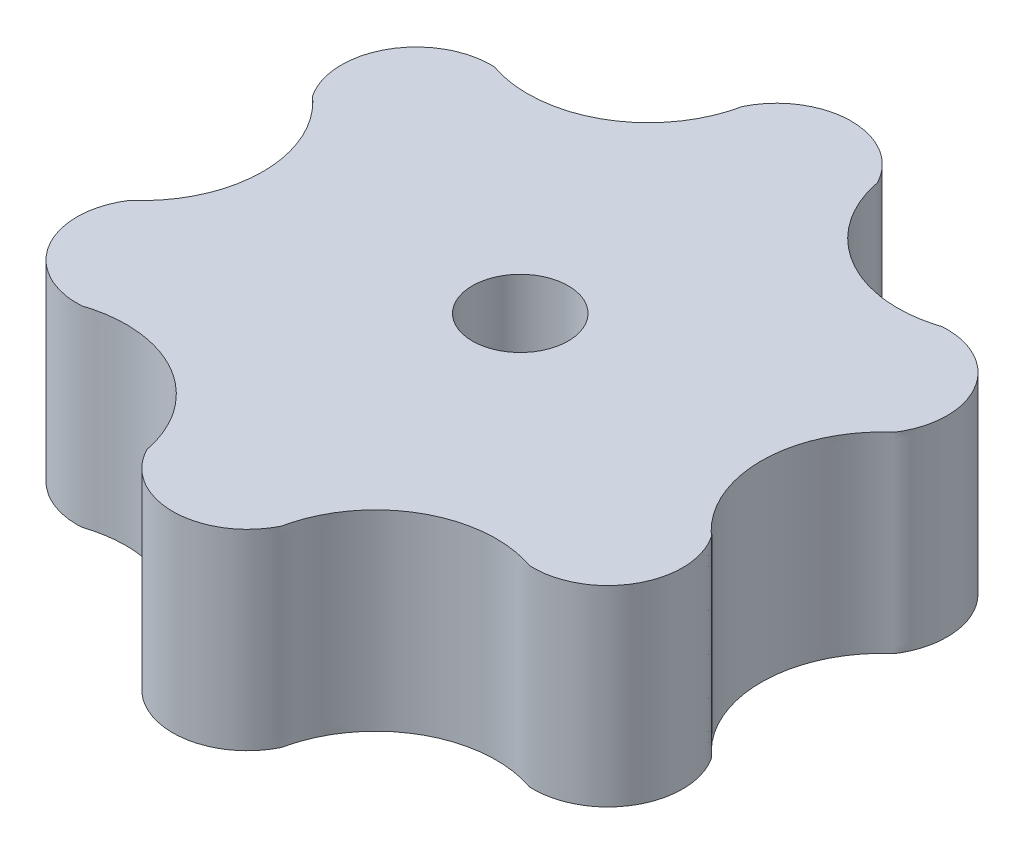
from build123d import *

# Parameters (mm, degrees)
EXTRUDE_1_DEPTH     = 20
SKETCH_3_R          = 5
CUT_EXTRUDE_1_DEPTH = 81.467811189


with BuildPart() as part:
    # 草图2 → 凸台-拉伸1 (new body)
    with BuildSketch(Plane.XZ):
        with BuildLine():
            add(Edge.make_bspline(
                [(0, 0), (0.037048104, 0.007327255), (0.073592948, 0.017199097), (0.147185896, 0.034398194), (0.257575318, 0.060196839), (0.367964741, 0.085995484), (0.588743585, 0.137592774), (0.731993745, 0.18653521), (0.948664485, 0.253313715), (1.021446681, 0.27396319), (1.162426399, 0.328475965), (1.303406118, 0.382988741), (1.444385837, 0.437501516), (1.585365556, 0.492014291), (1.652866118, 0.52625935), (1.858055963, 0.622709885), (1.996944408, 0.682933604), (2.260764564, 0.830536519), (2.392674642, 0.904337976), (2.557562239, 0.996589798), (2.58821449, 1.018871362), (2.651393533, 1.060345927), (2.746162098, 1.122557773), (2.856725423, 1.19513826), (2.935699227, 1.246981465), (2.967288748, 1.267718747), (2.983752674, 1.277142575), (3.028821983, 1.311517073), (3.118960601, 1.380266067), (3.239145424, 1.471931393), (3.329284042, 1.540680387), (3.389376454, 1.58651305), (3.420275984, 1.608388713), (3.505352052, 1.683311722), (3.618786809, 1.783209067), (3.732221567, 1.883106413), (3.817297635, 1.958029422), (3.845666165, 1.982993342), (3.898750117, 2.036787626), (3.978376047, 2.117479051), (4.058001976, 2.198170475), (4.164169881, 2.305759042), (4.218021081, 2.358847022), (4.365702211, 2.530881502), (4.464156298, 2.645571156), (4.587223906, 2.788933222), (4.609103355, 2.819794289), (4.654281279, 2.880380477), (4.722048164, 2.971259758), (4.789815049, 3.06213904), (4.92534882, 3.243897604), (5.004625157, 3.372762018), (5.127545598, 3.563277486), (5.169834711, 3.625994661), (5.243132771, 3.758185123), (5.316430831, 3.890375584), (5.38972889, 4.022566046), (5.435540178, 4.105185085), (5.436967022, 4.12460388), (5.444842291, 4.161562139), (5.456655193, 4.216999527), (5.468468095, 4.272436915), (5.507844437, 4.457228209), (5.537366909, 4.605547327), (5.613697906, 4.898055915), (5.649453958, 5.044970309), (5.774570036, 5.480823817), (5.868997273, 5.768153523), (6.178655793, 6.620562379), (6.426706694, 7.173687914), (6.785179557, 7.839022642), (6.862029079, 7.969223694), (6.974805174, 8.165914138), (7.011074053, 8.232310745), (7.092767977, 8.35948396), (7.133614939, 8.423070568), (7.256155825, 8.61383039), (7.335483539, 8.742605112), (7.510886902, 8.988819156), (7.598588583, 9.111926177), (7.773991946, 9.358140221), (7.869954288, 9.475064487), (8.010841588, 9.652705549), (8.057804022, 9.711919236), (8.151728889, 9.830346611), (8.201877598, 9.886959998), (8.351806289, 10.057039292), (8.449841582, 10.172163345), (8.604428955, 10.338019676), (8.655665565, 10.393584607), (8.761429702, 10.50157012), (8.81431177, 10.555562877), (9.078722112, 10.825526661), (9.300566119, 11.031220321), (9.585932888, 11.278927972), (9.641920159, 11.329752813), (9.758511893, 11.425946843), (9.816807759, 11.474043858), (9.933399492, 11.570237889), (9.994164106, 11.615255193), (10.113422544, 11.708122566), (10.173051762, 11.754556252), (10.351939418, 11.893857311), (10.477274205, 11.978577027), (10.66334863, 12.10812195), (10.725373438, 12.151303591), (10.849423054, 12.237666873), (10.913121909, 12.278361363), (11.103182215, 12.401984412), (11.233293803, 12.478999613), (11.426776626, 12.597194265), (11.492243651, 12.634942172), (11.623652215, 12.709632955), (11.688826556, 12.747942221), (11.889032374, 12.854352789), (12.021795975, 12.926675342), (12.225253822, 13.026727744), (12.293073104, 13.060078545), (12.428711668, 13.126780146), (12.497444061, 13.158205799), (12.63491584, 13.221042365), (12.703563122, 13.252662825), (12.842937936, 13.311157141), (12.912625343, 13.340404299), (13.121687564, 13.428145774), (13.261057355, 13.486934843), (13.54626694, 13.587150552), (13.688871732, 13.637258406), (13.974081316, 13.737474114), (14.119563463, 13.778764106), (14.410194856, 13.861957187), (14.554834701, 13.906045959), (14.774467382, 13.962322632), (14.848659945, 13.976991941), (14.996157757, 14.010027061), (15.143655569, 14.043062182), (15.291153381, 14.076097302), (15.438651194, 14.109132422), (15.513670901, 14.119139474), (15.737311977, 14.156425499), (15.886406028, 14.181282849), (16.184594129, 14.230997548), (16.335466428, 14.243137364), (16.636028153, 14.275546384), (16.786178657, 14.294185993), (17.088096561, 14.30945931), (17.239055514, 14.317095968), (17.540973418, 14.332369285), (17.692216112, 14.331329423), (17.918940617, 14.330073592), (17.994515453, 14.329654982), (18.145665123, 14.328817762), (18.221167175, 14.324782198), (18.447758663, 14.316916068), (18.59856207, 14.30627893), (18.824871786, 14.292513365), (18.899990086, 14.28369556), (19.050537446, 14.270189403), (19.125776554, 14.263099484), (19.275928742, 14.245743095), (19.35116818, 14.238322287), (19.500771129, 14.216737998), (19.575572603, 14.205945854), (19.799977026, 14.17356942), (19.949432863, 14.150694013), (20.245942727, 14.091790741), (20.394748578, 14.064943628), (20.689713385, 13.998735942), (20.835887509, 13.960151641), (21.055686422, 13.90452776), (21.129160749, 13.886768579), (21.2747537, 13.846153108), (21.346609765, 13.822639352), (21.491073333, 13.778173621), (21.59942101, 13.744824323), (21.725826632, 13.705916809), (21.78000047, 13.68924216), (21.807087389, 13.680904835), (21.816909796, 13.682904887), (21.835795041, 13.682329812), (21.996319622, 13.677441679), (22.156844203, 13.672553546), (22.345696652, 13.666802801), (22.383453813, 13.670257277), (22.45898021, 13.672994856), (22.572269805, 13.677101225), (22.6855594, 13.681207593), (22.798848995, 13.685313962), (22.8366213, 13.686553032), (22.911789323, 13.694395182), (23.024541357, 13.706158406), (23.174877402, 13.721842705), (23.287629436, 13.73360593), (23.362797459, 13.741448079), (23.400070471, 13.747603833), (23.511749842, 13.767074651), (23.660655669, 13.793035742), (23.809561497, 13.818996832), (23.921240868, 13.838467651), (23.957594175, 13.849109193), (24.030967718, 13.867221458), (24.141028033, 13.894389855), (24.251088347, 13.921558252), (24.361148662, 13.948726649), (24.398395758, 13.955812066), (24.470322619, 13.979012446), (24.57821291, 14.013813016), (24.722066632, 14.060213776), (24.829956923, 14.095014346), (24.901883784, 14.118214726), (24.938095402, 14.129129096), (25.113386772, 14.199636216), (25.253619868, 14.256041912), (25.428911238, 14.326549032), (25.463803079, 14.341025369), (25.531751289, 14.374112703), (25.633673605, 14.423743703), (25.735595921, 14.473374704), (25.871492341, 14.539549371), (25.940011933, 14.571561692), (26.07088896, 14.647179994), (26.201765987, 14.722798296), (26.332643013, 14.798416598), (26.46352004, 14.8740349), (26.52479581, 14.918494271), (26.712604644, 15.045511673), (26.840373555, 15.12667357), (27.078252974, 15.313224039), (27.197192683, 15.406499273), (27.34586732, 15.523093316), (27.372425396, 15.550183387), (27.428486685, 15.600867338), (27.512578617, 15.676893264), (27.59667055, 15.752919191), (27.764854415, 15.904971043), (27.866991214, 16.016641847), (28.024225119, 16.179991404), (28.078141077, 16.233089278), (28.175247338, 16.348922339), (28.272353598, 16.4647554), (28.369459859, 16.58058846), (28.46656612, 16.696421521), (28.508791372, 16.759287994), (28.597836883, 16.881426525), (28.642359638, 16.94249579), (28.709143771, 17.034099688), (28.732945232, 17.063588353), (28.773297993, 17.127489727), (28.833827136, 17.223341787), (28.894356279, 17.319193848), (28.975061802, 17.446996595), (29.016255495, 17.510405051), (29.124378948, 17.70969102), (29.196461249, 17.842548333), (29.277553839, 17.99201281), (29.284402478, 18.009701065), (29.300168374, 18.044043011), (29.323817217, 18.09555593), (29.378997851, 18.215752742), (29.426295537, 18.318778581), (29.473593224, 18.42180442), (29.489170441, 18.456225369), (29.515984176, 18.526884796), (29.556204779, 18.632873936), (29.609832249, 18.774192789), (29.650052852, 18.880181928), (29.676866587, 18.950841355), (29.709718909, 19.059340767), (29.764473379, 19.240172917), (29.808276955, 19.384838637), (29.841129636, 19.493337927), (29.847649537, 19.530679872), (29.864483352, 19.604357233), (29.889734075, 19.714873276), (29.914984798, 19.825389318), (29.94023552, 19.935905361), (29.95032394, 19.972423209), (29.961964931, 20.047097289), (29.979426416, 20.15910841), (29.996887902, 20.27111953), (30.020169882, 20.420467691), (30.034834137, 20.494779041), (30.053895797, 20.72070432), (30.06660357, 20.871321172), (30.082488287, 21.059592238), (30.084907693, 21.097283482), (30.085929208, 21.172852573), (30.08746148, 21.286206208), (30.088993751, 21.399559844), (30.09103678, 21.550698026), (30.092926782, 21.626286134), (30.084269801, 21.777190012), (30.07561282, 21.92809389), (30.066955839, 22.078997768), (30.058298859, 22.229901646), (30.045816346, 22.304596005), (30.016878612, 22.529469716), (30.001540976, 22.680036678), (29.941945096, 22.976408111), (29.912147156, 23.124593827), (29.878624473, 23.291302758), (29.872341069, 23.309217603), (29.86231902, 23.345652356), (29.847285947, 23.400304487), (29.812208776, 23.527826125), (29.78214263, 23.637130386), (29.722010338, 23.855738908), (29.667902244, 23.997092901), (29.59275452, 24.211005028), (29.569274415, 24.282921575), (29.509512543, 24.421757602), (29.449750671, 24.56059363), (29.389988799, 24.699429657), (29.330226927, 24.838265684), (29.292777073, 24.904117326), (29.223758731, 25.03859183), (29.189249559, 25.105829082), (29.137485803, 25.20668496), (29.121570615, 25.241048486), (29.082655203, 25.305835226), (29.024282084, 25.403015335), (28.94645126, 25.532588814), (28.888078141, 25.629768924), (28.858891582, 25.678358978), (28.851396161, 25.696395545), (28.823327078, 25.721694938), (28.697016202, 25.835542206), (28.570705326, 25.949389475), (28.402290824, 26.101185832), (28.349435847, 26.155289995), (28.241858197, 26.261468962), (28.188069371, 26.314558445), (28.026702896, 26.473826895), (27.923599548, 26.584384372), (27.410788634, 27.139540261), (27.032717103, 27.613193919), (26.604537496, 28.235958176), (26.523335338, 28.363475304), (26.399782149, 28.553581032), (26.360038413, 28.617862215), (26.280645909, 28.746484741), (26.244300849, 28.812803829), (26.130355472, 29.00881921), (26.052992711, 29.138758002), (25.91442361, 29.407433083), (25.845139059, 29.541770624), (25.741212233, 29.743276935), (25.710521127, 29.812365035), (25.647755217, 29.949869087), (25.616372262, 30.018621113), (25.553606352, 30.156125165), (25.52051048, 30.224123326), (25.461513605, 30.363286153), (25.43399248, 30.433677646), (25.350592884, 30.644509536), (25.29297818, 30.784298926), (25.189549518, 31.068359143), (25.143106671, 31.212235839), (25.04666664, 31.498744155), (25.003583332, 31.643659462), (24.942623545, 31.86203868), (24.922303616, 31.934831753), (24.881663758, 32.080417898), (24.864422606, 32.154024231), (24.827864407, 32.300688548), (24.810459842, 32.374227167), (24.777564605, 32.521756239), (24.759454914, 32.595174619), (24.716350374, 32.817767469), (24.685960319, 32.965863892), (24.648440569, 33.189465875), (24.635621128, 33.263951904), (24.614826584, 33.413666668), (24.604429312, 33.48852405), (24.573237495, 33.713096197), (24.554524329, 33.863103847), (24.535365687, 34.089020922), (24.528979473, 34.164326614), (24.516207046, 34.314937997), (24.508063376, 34.390122503), (24.500042238, 34.541061514), (24.495475595, 34.616509362), (24.488576239, 34.767492064), (24.488244822, 34.843104866), (24.48450187, 34.994210505), (24.482630394, 35.069763324), (24.478887442, 35.220868963), (24.481310509, 35.296460504), (24.482837048, 35.523183349), (24.489182685, 35.67422046), (24.497138624, 35.900808813), (24.502987788, 35.976175674), (24.513035456, 36.126993339), (24.517106145, 36.202479264), (24.535091239, 36.428470106), (24.55149837, 36.578780006), (24.589555679, 36.878678882), (24.607601697, 37.028767148), (24.654115433, 37.327471295), (24.683172036, 37.475827356), (24.725027745, 37.698658409), (24.737153227, 37.773305136), (24.769220408, 37.921016408), (24.785552643, 37.99480234), (24.84050486, 38.214770139), (24.877139671, 38.361415338), (24.950409293, 38.654705736), (24.995311714, 38.799095917), (25.060654438, 39.01620397), (25.08289613, 39.088427649), (25.130450497, 39.231904149), (25.153111057, 39.30403642), (25.232643226, 39.516357433), (25.285664672, 39.657904775), (25.365196841, 39.870225787), (25.390514646, 39.941467211), (25.447835822, 40.081328595), (25.47910203, 40.150149735), (25.540208793, 40.288399101), (25.570762175, 40.357523784), (25.631868938, 40.495773151), (25.661182543, 40.565468158), (25.759010339, 40.770004953), (25.828524147, 40.904236931), (25.966254133, 41.173343129), (26.035347709, 41.307871859), (26.187946372, 41.5688342), (26.261681889, 41.700865173), (26.381789431, 41.893166388), (26.421825278, 41.957266792), (26.501896972, 42.085467602), (26.544818044, 42.147713267), (26.628202666, 42.273784392), (26.669811225, 42.336877092), (26.756778108, 42.460504294), (26.80026155, 42.522317895), (26.930711875, 42.707758697), (27.0216654, 42.82854626), (27.208646167, 43.066087599), (27.301812784, 43.185119798), (27.494722352, 43.417872013), (27.595944245, 43.530184765), (27.745389264, 43.700689208), (27.796001199, 43.756807898), (27.898413039, 43.867977762), (27.952223816, 43.921097076), (28.110296786, 44.083634809), (28.213265747, 44.194492954), (28.434737544, 44.400254801), (28.559315431, 44.515995841), (28.690814311, 44.638166937), (28.711577292, 44.657457111), (28.725419279, 44.670317226), (28.730561595, 44.678209669), (28.755414862, 44.718377567), (28.815062702, 44.814780522), (28.894593156, 44.943317795), (28.954240997, 45.03972075), (28.994006224, 45.103989387), (29.012081358, 45.137160341), (29.065170101, 45.237325105), (29.135955092, 45.370878124), (29.206740083, 45.504431143), (29.250980702, 45.587901779), (29.257648403, 45.605658596), (29.273044014, 45.640168129), (29.29613743, 45.69193243), (29.350022068, 45.812715797), (29.3962089, 45.916244398), (29.442395732, 46.019772998), (29.458108549, 46.054153879), (29.48409372, 46.125122195), (29.523071475, 46.231574669), (29.562049231, 46.338027142), (29.614019571, 46.479963774), (29.640960909, 46.550619166), (29.703961671, 46.768418345), (29.745962178, 46.913617798), (29.80896294, 47.131416977), (29.821699573, 47.206096798), (29.853447062, 47.35387711), (29.877257679, 47.464712344), (29.901068296, 47.575547579), (29.916942041, 47.649437735), (29.920360205, 47.687188204), (29.936308731, 47.799424736), (29.952257256, 47.911661268), (29.968205782, 48.0238978), (29.978838132, 48.098722155), (29.986407465, 48.135895071), (29.994385438, 48.24897799), (30.005022736, 48.399755216), (30.015660035, 48.550532441), (30.023638008, 48.66361536), (30.02751732, 48.701266887), (30.027492252, 48.776842878), (30.02745465, 48.890206863), (30.027417048, 49.003570849), (30.027366911, 49.154722829), (30.030185189, 49.230400309), (30.014095337, 49.45655666), (30.003368768, 49.60732756), (29.987278916, 49.833483912), (29.975663609, 49.908202583), (29.954351138, 50.057844497), (29.938366786, 50.170075933), (29.922382433, 50.282307368), (29.911726198, 50.357128325), (29.904151972, 50.394138276), (29.880358302, 50.50497715), (29.848633408, 50.652762314), (29.816908515, 50.800547479), (29.793114844, 50.911386352), (29.781444646, 50.947393197), (29.760496016, 51.020007836), (29.72907307, 51.128929795), (29.697650124, 51.237851754), (29.666227178, 51.346773712), (29.657679574, 51.383709245), (29.6317998, 51.454716063), (29.592980138, 51.56122629), (29.554160477, 51.667736517), (29.502400928, 51.809750153), (29.478565474, 51.881581528), (29.386682701, 52.088857032), (29.325427519, 52.227040701), (29.233544746, 52.434316205), (29.195522723, 52.49983059), (29.125194256, 52.633624575), (29.090030022, 52.700521567), (28.984537321, 52.901212545), (28.902025201, 53.028078656), (28.803252757, 53.189144862), (28.783498269, 53.221358103), (28.743989291, 53.285784586), (28.722222153, 53.316669307), (28.65665243, 53.409146364), (28.591082708, 53.501623421), (28.525512985, 53.594100478), (28.481799836, 53.655751849), (28.461820606, 53.688006637), (28.390138572, 53.775830783), (28.294562527, 53.892929645), (28.198986483, 54.010028507), (28.127304449, 54.097852653), (28.103413062, 54.127129665), (28.051723246, 54.182264897), (27.974188522, 54.264967746), (27.87080889, 54.375238211), (27.793274166, 54.45794106), (27.741584351, 54.513076293), (27.714357685, 54.539255329), (27.575884814, 54.667799416), (27.465106517, 54.770634686), (27.326633646, 54.899178774), (27.296594272, 54.922177284), (27.237743341, 54.969593514), (27.149466944, 55.040717859), (27.031765082, 55.135550319), (26.943488686, 55.206674664), (26.884637755, 55.254090894), (26.852254105, 55.273850681), (26.759193015, 55.338588831), (26.666131924, 55.403326981), (26.573070834, 55.468065131), (26.511030107, 55.511223897), (26.481047715, 55.534413998), (26.383644518, 55.5924141), (26.253773589, 55.669747569), (26.12390266, 55.747081039), (26.026499463, 55.805081141), (25.994451037, 55.825178967), (25.92694388, 55.859157117), (25.825683144, 55.910124342), (25.724422408, 55.961091566), (25.589408094, 56.029047866), (25.522943801, 56.065294227), (25.313726947, 56.152666342), (25.174249044, 56.210914418), (24.96503219, 56.298286533), (24.892954505, 56.321204575), (24.749724152, 56.369495253), (24.642301387, 56.405713262), (24.534878622, 56.44193127), (24.463263445, 56.466076609), (24.426703879, 56.475630936), (24.317010247, 56.5042439), (24.170752071, 56.542394519), (24.024493895, 56.580545138), (23.914800263, 56.609158102), (23.877317785, 56.614599806), (23.80304214, 56.628559011), (23.691628671, 56.649497818), (23.580215203, 56.670436625), (23.468801734, 56.691375432), (23.43191846, 56.70002288), (23.356860337, 56.708855159), (23.244273153, 56.722103579), (23.131685969, 56.735351999), (22.981569724, 56.753016559), (22.906667127, 56.76371238), (22.680215676, 56.774906977), (22.529248043, 56.782370041), (22.340538501, 56.791698872), (22.302740363, 56.790060465), (22.227175685, 56.788752692), (22.113828666, 56.786791033), (21.981590479, 56.78450243), (21.877689045, 56.782704243), (21.849352291, 56.782213828), (21.835183914, 56.781968621), (21.830901166, 56.779251865), (21.821915016, 56.776337263), (21.781477342, 56.763221552), (21.669150469, 56.726789022), (21.561316671, 56.691813793), (21.417538274, 56.645180154), (21.345746547, 56.621550153), (21.200898272, 56.578354079), (21.1276055, 56.55978722), (20.908992506, 56.499671188), (20.763390802, 56.458885783), (20.468517622, 56.392271201), (20.321340162, 56.3577471), (19.876696458, 56.268784801), (19.578038217, 56.220981778), (18.978328489, 56.14417668), (18.676969808, 56.118371523), (18.224143238, 56.094488231), (18.07316491, 56.086143905), (17.846437944, 56.085464417), (17.770862289, 56.085237921), (17.619710979, 56.084784929), (17.5441219, 56.083038351), (17.317442298, 56.087721993), (17.16653534, 56.097094469), (16.97780759, 56.106047398), (16.940062041, 56.107837984), (16.864570941, 56.111419156), (16.826750741, 56.112166107), (16.713902352, 56.122965912), (16.563437834, 56.137365654), (16.412973316, 56.151765395), (16.262508798, 56.166165136), (16.187089676, 56.172021742), (15.962803669, 56.205208571), (15.813279665, 56.227333123), (15.514231656, 56.271582228), (15.366042301, 56.301636482), (15.143785352, 56.3464408), (15.069699702, 56.361375572), (14.921528402, 56.391245118), (14.848224741, 56.409798978), (14.700939608, 56.443769747), (14.628084912, 56.463988259), (14.481683406, 56.501585105), (14.408209964, 56.51938013), (14.190270403, 56.581893536), (14.045235181, 56.62442755), (13.612599945, 56.760254891), (13.327336757, 56.861002268), (12.907177127, 57.031554897), (12.7669036, 57.087881971), (12.559029434, 57.178402188), (12.491035524, 57.211443531), (12.354217194, 57.275690463), (12.285808028, 57.307813929), (12.080580533, 57.404184328), (11.945107651, 57.471331444), (11.679644275, 57.615958174), (11.545512825, 57.685795745), (11.349924624, 57.800472831), (11.284728557, 57.838698527), (11.154336423, 57.915149918), (11.090790883, 57.956101276), (10.962620926, 58.036222347), (10.897692014, 58.074978966), (10.772107852, 58.159095207), (10.709315771, 58.201153328), (10.583731609, 58.285269569), (10.52093413, 58.327319871), (10.397778568, 58.414953378), (10.336200788, 58.458770131), (10.213045226, 58.546403638), (10.154147802, 58.593864709), (10.033804549, 58.685321941), (9.973632923, 58.731050557), (9.793118044, 58.868236405), (9.67816186, 58.966522139), (9.448766502, 59.163411612), (9.332839358, 59.26046383), (9.109045807, 59.463698034), (9.002184563, 59.570689534), (8.83916567, 59.728266243), (8.784826039, 59.780791812), (8.676146777, 59.885842951), (8.625822424, 59.942329462), (8.47228834, 60.109161304), (8.369932285, 60.220382533), (8.165220173, 60.442824989), (8.071004427, 60.561133522), (7.926893558, 60.73616962), (7.878856601, 60.794514987), (7.782782689, 60.911205719), (7.734532914, 60.969428391), (7.60076554, 61.152490861), (7.51158729, 61.274532508), (7.377819916, 61.457594979), (7.333967923, 61.519137608), (7.248502297, 61.643807374), (7.208055501, 61.707664781), (7.084914406, 61.898037702), (7.001792881, 62.024309772), (6.845198834, 62.28289438), (6.771161882, 62.41469015), (6.62145782, 62.677323714), (6.549499823, 62.81031285), (6.448268437, 63.013186666), (6.414524642, 63.080811271), (6.347037051, 63.216060481), (6.315155529, 63.284581208), (6.251575213, 63.421710589), (6.218325242, 63.489621041), (6.158281752, 63.628335507), (6.128260007, 63.69769274), (6.038194773, 63.905764439), (5.984845573, 64.04726525), (5.872623225, 64.327967654), (5.825213262, 64.471611717), (5.72795763, 64.757844205), (5.677917497, 64.90056921), (5.595609924, 65.19145262), (5.554456137, 65.336894325), (5.492725457, 65.555056883), (5.476201591, 65.628836658), (5.442474655, 65.776177818), (5.408747719, 65.923518979), (5.375020782, 66.070860139), (5.35604938, 66.153739542), (5.354145216, 66.16302485), (5.345200942, 66.17966766), (5.33178453, 66.204631876), (5.300479571, 66.262881713), (5.237869652, 66.379381387), (5.184204007, 66.479238251), (5.130538362, 66.579095114), (5.11302627, 66.612599531), (5.072892834, 66.67663888), (5.012692679, 66.772697904), (4.932425807, 66.900776602), (4.872225652, 66.996835625), (4.832092216, 67.060874975), (4.810013355, 67.091536601), (4.699070514, 67.244474511), (4.61031624, 67.366824839), (4.499373398, 67.519762749), (4.473364096, 67.547373504), (4.424897536, 67.605362498), (4.352197696, 67.692345991), (4.279497856, 67.779329483), (4.134098177, 67.953296467), (4.026194623, 68.059438993), (3.869076087, 68.22289952), (3.818131788, 68.278859065), (3.706020956, 68.380239956), (3.593910124, 68.481620847), (3.481799292, 68.583001739), (3.36968846, 68.68438263), (3.308963033, 68.729528294), (3.189996317, 68.822769081), (3.10077128, 68.892699671), (3.011546243, 68.962630261), (2.952062885, 69.009250654), (2.920508825, 69.030072028), (2.763938869, 69.135827251), (2.638682905, 69.22043143), (2.482112949, 69.326186654), (2.448610122, 69.343836045), (2.383146729, 69.381602102), (2.284951638, 69.438251187), (2.154024851, 69.513783301), (2.055829761, 69.570432386), (2.006732216, 69.598756929), (1.989195871, 69.605992932), (1.955212106, 69.622516745), (1.870252691, 69.663826277), (1.75130951, 69.721659622), (1.649358213, 69.771231061), (1.581390681, 69.804278687), (1.5480942, 69.822352566), (1.442906443, 69.864624665), (1.3026561, 69.920987464), (1.162405757, 69.977350263), (1.057218, 70.019622362), (1.02227873, 70.034053929), (0.950354304, 70.057261855), (0.842467664, 70.092073744), (0.734581024, 70.126885632), (0.590732172, 70.173301484), (0.519187835, 70.197844131), (0.29910637, 70.252339332), (0.152385392, 70.288669465), (-0.067696073, 70.343164666), (-0.14278357, 70.353163749), (-0.291650508, 70.379346921), (-0.366083977, 70.392438507), (-0.589384384, 70.431713265), (-0.7400903, 70.444867472), (-0.965537649, 70.468931372), (-1.04055088, 70.478810645), (-1.191583907, 70.484806361), (-1.342616933, 70.490802077), (-1.49364996, 70.496797793), (-1.60692473, 70.50129458), (-1.644709485, 70.498769907), (-1.720258933, 70.496766939), (-1.833583105, 70.493762487), (-1.946907277, 70.490758035), (-2.060231448, 70.487753583), (-2.098012566, 70.486858819), (-2.173260698, 70.479826776), (-2.286132895, 70.469278713), (-2.436629159, 70.455214628), (-2.549501356, 70.444666564), (-2.624749488, 70.437634521), (-2.662023628, 70.4313792), (-2.848522299, 70.401104392), (-2.997721236, 70.376884545), (-3.16557004, 70.349637218), (-3.183716943, 70.344066649), (-3.220513417, 70.3354671), (-3.275708129, 70.322567778), (-3.404495788, 70.292469358), (-3.51488521, 70.266670713), (-3.735664054, 70.215073423), (-3.878914617, 70.166132477), (-4.095585358, 70.099353972), (-4.168368064, 70.078705968), (-4.309347782, 70.024193193), (-4.450327501, 69.969680418), (-4.59130722, 69.915167643), (-4.732286939, 69.860654867), (-4.799788117, 69.82641125), (-5.004977963, 69.729960714), (-5.143867891, 69.66973976), (-5.407684486, 69.522130481), (-5.539592784, 69.448325842), (-5.704478156, 69.356070042), (-5.7351326, 69.333792035), (-5.798312601, 69.29231893), (-5.893082603, 69.230109274), (-6.003647606, 69.157531341), (-6.082622607, 69.105689961), (-6.114212608, 69.084953409), (-6.130678072, 69.07553178), (-6.175746624, 69.04115629), (-6.265883727, 68.97240531), (-6.38606653, 68.880737336), (-6.476203633, 68.811986355), (-6.536295035, 68.766152368), (-6.567195171, 68.744277374), (-6.652271239, 68.669354365), (-6.765705996, 68.56945702), (-6.879140753, 68.469559674), (-6.964216821, 68.394636666), (-6.992586818, 68.369674298), (-7.045671831, 68.31588106), (-7.12529935, 68.235191205), (-7.20492687, 68.154501349), (-7.311096895, 68.046914875), (-7.364950584, 67.993829257), (-7.512628539, 67.821792051), (-7.611080509, 67.707100581), (-7.734145472, 67.563736243), (-7.756027483, 67.532877201), (-7.801206446, 67.472291787), (-7.868974889, 67.381413667), (-7.936743333, 67.290535547), (-8.07228022, 67.108779307), (-8.151556958, 66.979915138), (-8.274477398, 66.789399669), (-8.316767603, 66.726683149), (-8.390065663, 66.594492687), (-8.463363723, 66.462302225), (-8.536661782, 66.330111763), (-8.582473069, 66.247492724), (-8.583905024, 66.228075868), (-8.591780072, 66.191117562), (-8.603592643, 66.135680103), (-8.615405215, 66.080242645), (-8.654780454, 65.895451116), (-8.684304837, 65.747132497), (-8.760633469, 65.454623292), (-8.79638365, 65.307707275), (-8.92151334, 64.871857674), (-9.015934253, 64.584526337), (-9.325580263, 63.732112937), (-9.573661706, 63.179002617), (-9.932102925, 62.513650841), (-10.008962543, 62.383455488), (-10.121746605, 62.186769611), (-10.158006362, 62.120367443), (-10.239698525, 61.993193097), (-10.280544607, 61.929605924), (-10.403082852, 61.738844405), (-10.48240682, 61.610067233), (-10.657810183, 61.363853189), (-10.745511864, 61.240746167), (-10.920915227, 60.994532123), (-11.016886615, 60.877614797), (-11.157777818, 60.69997683), (-11.204741552, 60.640764174), (-11.298669021, 60.522338862), (-11.348798806, 60.465709662), (-11.498731128, 60.29563357), (-11.596769922, 60.180512592), (-11.751357295, 60.014656261), (-11.802593543, 59.959090984), (-11.908357679, 59.851105471), (-11.961239748, 59.797112714), (-12.22565009, 59.52714893), (-12.447495842, 59.321456984), (-12.732855191, 59.073740783), (-12.788839173, 59.022912141), (-12.905430907, 58.92671811), (-12.963726773, 58.878621095), (-13.080318506, 58.782427064), (-13.141082591, 58.7374091), (-13.260341029, 58.644541727), (-13.319970247, 58.598108041), (-13.498857903, 58.458806982), (-13.624199184, 58.374096053), (-13.810273608, 58.24455113), (-13.872298416, 58.201369489), (-13.996348033, 58.115006207), (-14.060043837, 58.074307048), (-14.250097756, 57.950674178), (-14.380214275, 57.873666863), (-14.573700393, 57.755477606), (-14.639167293, 57.717729473), (-14.770575858, 57.643038691), (-14.835749908, 57.604728897), (-15.035955726, 57.498318329), (-15.168719759, 57.425996677), (-15.372174218, 57.325937388), (-15.439992371, 57.292584291), (-15.575628677, 57.225878098), (-15.644360726, 57.194451719), (-15.781832504, 57.131615153), (-15.850479434, 57.099993888), (-15.989854248, 57.041499572), (-16.059541655, 57.012252414), (-16.268603876, 56.92451094), (-16.407979236, 56.86573652), (-16.693186232, 56.765513444), (-16.835789729, 56.715401906), (-17.120996724, 56.615178831), (-17.266479104, 56.573889353), (-17.557110497, 56.490696272), (-17.70175014, 56.446606757), (-17.921382821, 56.390330084), (-17.995575187, 56.375659957), (-18.143073, 56.342624837), (-18.290570812, 56.309589716), (-18.438068624, 56.276554596), (-18.585566436, 56.243519476), (-18.660585853, 56.233510933), (-18.884226929, 56.196224908), (-19.033320979, 56.171367558), (-19.331509081, 56.121652858), (-19.482383199, 56.109526504), (-19.782944924, 56.077117484), (-19.933095314, 56.058476429), (-20.235013219, 56.043203112), (-20.385972171, 56.035566454), (-20.687890075, 56.020293137), (-20.839132737, 56.021331569), (-21.065857242, 56.022587399), (-21.141432078, 56.023006009), (-21.292581748, 56.02384323), (-21.368083815, 56.02787805), (-21.594675303, 56.035744179), (-21.745478741, 56.046380654), (-21.971788457, 56.060146219), (-22.046906813, 56.068963293), (-22.197454172, 56.08246945), (-22.272693347, 56.089558719), (-22.422845535, 56.106915108), (-22.498084838, 56.114336784), (-22.647688554, 56.135915756), (-22.722490412, 56.146705243), (-22.946895985, 56.179073701), (-23.096349604, 56.201962074), (-23.392859468, 56.260865346), (-23.541665451, 56.287711834), (-23.836630258, 56.35391952), (-23.982804545, 56.39250314), (-24.202603459, 56.44812702), (-24.276077947, 56.465885596), (-24.421670897, 56.506501067), (-24.493528057, 56.530011235), (-24.637992708, 56.574473449), (-24.746341196, 56.607820109), (-24.872747766, 56.646724546), (-24.92692201, 56.663397876), (-24.954009132, 56.671734541), (-24.963830523, 56.669740871), (-24.982715751, 56.670316503), (-25.143240188, 56.675209383), (-25.303764624, 56.680102262), (-25.492616903, 56.68585859), (-25.530374096, 56.682404648), (-25.605900493, 56.679667069), (-25.719190088, 56.6755607), (-25.832479683, 56.671454332), (-25.945769278, 56.667347963), (-25.983541693, 56.666110419), (-26.058709515, 56.658266349), (-26.171461248, 56.646500244), (-26.321796893, 56.630812104), (-26.434548626, 56.619045999), (-26.509716449, 56.611201929), (-26.546989943, 56.605049421), (-26.658669762, 56.585581177), (-26.807576188, 56.559623518), (-26.956482614, 56.533665859), (-27.068162434, 56.514197615), (-27.104515948, 56.503556967), (-27.177889491, 56.485444702), (-27.287949806, 56.458276305), (-27.39801012, 56.431107908), (-27.508070435, 56.403939511), (-27.545317856, 56.396855268), (-27.617244915, 56.373655503), (-27.725135504, 56.338855855), (-27.868989622, 56.292456325), (-27.976880211, 56.257656677), (-28.04880727, 56.234456912), (-28.085020004, 56.223545632), (-28.260308833, 56.153032193), (-28.400539895, 56.096621442), (-28.575828724, 56.026108003), (-28.610720973, 56.011632471), (-28.678670005, 55.978546826), (-28.780593554, 55.928918358), (-28.882517103, 55.87928989), (-29.018415168, 55.8131186), (-29.086936651, 55.781109982), (-29.217811869, 55.705488548), (-29.348687086, 55.629867113), (-29.479562303, 55.554245679), (-29.61043752, 55.478624245), (-29.671716189, 55.434169392), (-29.859527939, 55.307156302), (-29.987300395, 55.22599956), (-30.225179814, 55.039449092), (-30.344119523, 54.946173858), (-30.492794159, 54.829579815), (-30.51935213, 54.802489697), (-30.575412364, 54.75180458), (-30.659502714, 54.675776903), (-30.743593064, 54.599749227), (-30.911773765, 54.447693874), (-31.013912773, 54.336025407), (-31.171146678, 54.172675851), (-31.225063734, 54.119578988), (-31.322172129, 54.003747716), (-31.419280524, 53.887916445), (-31.516388919, 53.772085174), (-31.613497314, 53.656253902), (-31.655722917, 53.59338767), (-31.744768428, 53.471249139), (-31.789291183, 53.410179873), (-31.856075316, 53.318575975), (-31.879877769, 53.289087984), (-31.920230531, 53.225186611), (-31.980759673, 53.12933455), (-32.041288816, 53.03348249), (-32.12199434, 52.905679742), (-32.163189058, 52.842271888), (-32.271312511, 52.642985919), (-32.343394812, 52.510128606), (-32.424487402, 52.360664129), (-32.431337114, 52.342976411), (-32.44710301, 52.308634464), (-32.470751853, 52.257121545), (-32.525932487, 52.136924733), (-32.573230173, 52.033898894), (-32.62052786, 51.930873055), (-32.6361062, 51.896452576), (-32.662919935, 51.82579315), (-32.703140538, 51.71980401), (-32.756768008, 51.578485157), (-32.796988611, 51.472496017), (-32.823802346, 51.401836591), (-32.856654946, 51.293337307), (-32.911407931, 51.112504707), (-32.955210319, 50.967838628), (-32.988062109, 50.859339068), (-32.994584418, 50.82199777), (-33.011418233, 50.748320408), (-33.036668955, 50.637804366), (-33.061919678, 50.527288324), (-33.087170401, 50.416772281), (-33.097260956, 50.380254847), (-33.108902267, 50.305580816), (-33.126364233, 50.19356977), (-33.143826199, 50.081558725), (-33.167108821, 49.932210664), (-33.181773614, 49.857899439), (-33.200841512, 49.631974687), (-33.213553444, 49.481358185), (-33.22944336, 49.293087558), (-33.231864541, 49.255396438), (-33.232883967, 49.179827319), (-33.234413105, 49.066473641), (-33.235942244, 48.953119963), (-33.237981096, 48.801981725), (-33.239869966, 48.726393556), (-33.231213224, 48.575489665), (-33.222556482, 48.424585773), (-33.21389974, 48.273681881), (-33.205242998, 48.122777989), (-33.192762395, 48.048083465), (-33.163823866, 47.823209856), (-33.148486799, 47.672642774), (-33.088890919, 47.376271342), (-33.059092978, 47.228085625), (-33.025570296, 47.061376695), (-33.019288163, 47.043461548), (-33.009266115, 47.007026794), (-32.994233042, 46.952374663), (-32.959155871, 46.824853025), (-32.929089725, 46.715548764), (-32.868957433, 46.496940242), (-32.814850576, 46.355585862), (-32.739702852, 46.141673735), (-32.716223942, 46.069756721), (-32.65646207, 45.930920694), (-32.596700198, 45.792084667), (-32.536938326, 45.65324864), (-32.477176454, 45.514412613), (-32.439727744, 45.448560432), (-32.370709402, 45.314085928), (-32.336200231, 45.246848676), (-32.284436474, 45.145992798), (-32.268522376, 45.111628666), (-32.229606963, 45.046841926), (-32.171233845, 44.949661817), (-32.09340302, 44.820088337), (-32.035029902, 44.722908228), (-32.005843343, 44.674318173), (-31.998352041, 44.656278253), (-31.970283495, 44.630978264), (-31.84397504, 44.517128309), (-31.717666585, 44.403278355), (-31.549255312, 44.251478416), (-31.496392238, 44.197382921), (-31.388817008, 44.091201503), (-31.335029393, 44.038110794), (-31.173666547, 43.878838667), (-31.070554009, 43.768290101), (-30.557743096, 43.213134213), (-30.179669405, 42.739481995), (-29.751489798, 42.116717739), (-29.670287252, 41.98920087), (-29.546734063, 41.799095142), (-29.506993252, 41.734812159), (-29.427607522, 41.606185453), (-29.391256624, 41.539869886), (-29.277308324, 41.343856205), (-29.199949819, 41.213915143), (-29.061377563, 40.945241689), (-28.992091435, 40.810904962), (-28.888162243, 40.609399871), (-28.857470548, 40.540312052), (-28.794704638, 40.402808), (-28.763321683, 40.334055974), (-28.700555773, 40.196551922), (-28.667459464, 40.128553954), (-28.60846259, 39.989391127), (-28.580941913, 39.918999462), (-28.497544492, 39.708166711), (-28.43993379, 39.568375808), (-28.336495042, 39.284319264), (-28.287288296, 39.141374624), (-28.147795572, 38.709907251), (-28.066215697, 38.418667247), (-27.974815758, 38.052007562), (-27.957409852, 37.978469265), (-27.924514615, 37.830940193), (-27.906403928, 37.757522021), (-27.863299388, 37.53492917), (-27.832908443, 37.386832909), (-27.795388693, 37.163230925), (-27.782568192, 37.088745059), (-27.761774324, 36.9390302), (-27.75137739, 36.864172771), (-27.720186587, 36.639600483), (-27.701468407, 36.48959337), (-27.682316069, 36.26367576), (-27.675931956, 36.18836989), (-27.66316373, 36.03775815), (-27.65502606, 35.962573227), (-27.646995632, 35.81163471), (-27.642438289, 35.736186583), (-27.635501252, 35.585205447), (-27.635187964, 35.509591892), (-27.631445135, 35.35848625), (-27.62957372, 35.282933429), (-27.62583089, 35.131827787), (-27.628252348, 35.056236262), (-27.629778959, 34.829513419), (-27.636123315, 34.678476277), (-27.644078941, 34.451887913), (-27.649926799, 34.376520989), (-27.659974845, 34.225703349), (-27.664057829, 34.150218417), (-27.682005797, 33.924224561), (-27.698434079, 33.77391631), (-27.736492584, 33.474017585), (-27.754538341, 33.323929271), (-27.801052077, 33.025225125), (-27.830107582, 32.876868875), (-27.871963291, 32.654037823), (-27.884081367, 32.579389501), (-27.916163179, 32.431681407), (-27.932500377, 32.357896525), (-27.987447435, 32.137927438), (-28.024078807, 31.99128138), (-28.079025865, 31.771312293), (-28.098543358, 31.698295159), (-28.143682041, 31.554040443), (-28.188820724, 31.409785727), (-28.233959407, 31.265531011), (-28.279098089, 31.121276296), (-28.300058152, 31.048596223), (-28.379590321, 30.83627521), (-28.432611767, 30.694727868), (-28.512143936, 30.482406855), (-28.537462143, 30.411165589), (-28.594783319, 30.271304205), (-28.626049881, 30.202483216), (-28.687156644, 30.064233849), (-28.717710026, 29.995109166), (-28.778816789, 29.8568598), (-28.808125356, 29.787162376), (-28.905980135, 29.582638488), (-28.975485009, 29.448402037), (-29.113204394, 29.179290413), (-29.182295516, 29.044760326), (-29.334898739, 28.783800652), (-29.408641171, 28.65177383), (-29.528743437, 28.459469322), (-29.568777526, 28.395367819), (-29.648845703, 28.267164813), (-29.691768407, 28.204920173), (-29.775153029, 28.078849048), (-29.816761871, 28.015756539), (-29.90373176, 27.892131451), (-29.947216704, 27.830318907), (-30.077671536, 27.644881276), (-30.168624479, 27.524093352), (-30.355605246, 27.286552013), (-30.448772988, 27.167520735), (-30.641671766, 26.934759577), (-30.742900225, 26.822452444), (-30.892348773, 26.651951094), (-30.942961709, 26.595833293), (-31.045373549, 26.484663428), (-31.099184859, 26.431544619), (-31.257257829, 26.269006886), (-31.360218645, 26.158140352), (-31.581694283, 25.952382639), (-31.70627433, 25.836643924), (-31.83777549, 25.714475282), (-31.858538831, 25.695185496), (-31.872381058, 25.682325639), (-31.877517847, 25.674428654), (-31.902371114, 25.634260756), (-31.962018954, 25.537857801), (-32.041549408, 25.409320528), (-32.101197249, 25.312917573), (-32.140962476, 25.248648936), (-32.159036058, 25.215477092), (-32.212124801, 25.115312328), (-32.282909792, 24.981759309), (-32.353694783, 24.84820629), (-32.397935402, 24.764735654), (-32.40460147, 24.746978041), (-32.419997081, 24.712468508), (-32.443090497, 24.660704207), (-32.496975135, 24.53992084), (-32.543161967, 24.436392239), (-32.589348799, 24.332863639), (-32.605059911, 24.298482067), (-32.631045081, 24.227513751), (-32.670022836, 24.121061277), (-32.709000592, 24.014608803), (-32.760970932, 23.872672171), (-32.787910501, 23.802016201), (-32.850911263, 23.584217021), (-32.89291177, 23.439017568), (-32.955912532, 23.221218389), (-32.968647345, 23.14653811), (-33.000394835, 22.998757798), (-33.024205452, 22.887922564), (-33.048016069, 22.77708733), (-33.063889814, 22.703197174), (-33.067306117, 22.665446373), (-33.083254643, 22.553209841), (-33.099203168, 22.440973309), (-33.115151694, 22.328736777), (-33.125784045, 22.253912422), (-33.133351491, 22.216739305), (-33.141329465, 22.103656386), (-33.151966763, 21.952879161), (-33.162604061, 21.802101936), (-33.170582035, 21.689019017), (-33.17445945, 21.651367423), (-33.174434382, 21.575791432), (-33.174396779, 21.462427447), (-33.174359177, 21.349063462), (-33.174309041, 21.197911481), (-33.177125424, 21.122234069), (-33.161035572, 20.896077718), (-33.150309004, 20.745306817), (-33.134219151, 20.519150466), (-33.122602313, 20.444431945), (-33.10129043, 20.294789948), (-33.085306518, 20.18255845), (-33.069322606, 20.070326951), (-33.058666664, 19.995505953), (-33.051091464, 19.958496183), (-33.027297141, 19.847657449), (-32.995571377, 19.699872472), (-32.963845613, 19.552087494), (-32.94005129, 19.44124876), (-32.928379402, 19.405242344), (-32.907430771, 19.332627705), (-32.876007825, 19.223705746), (-32.844584879, 19.114783787), (-32.813161933, 19.005861829), (-32.804612592, 18.968926863), (-32.778732818, 18.897920045), (-32.739913156, 18.791409818), (-32.701093494, 18.684899591), (-32.649333946, 18.542885954), (-32.625496819, 18.471055255), (-32.533614046, 18.263779751), (-32.472358864, 18.125596082), (-32.380476091, 17.918320578), (-32.342455324, 17.852805466), (-32.27213036, 17.719009639), (-32.236967878, 17.652111726), (-32.131480432, 17.451417986), (-32.048963201, 17.324554799), (-31.950189186, 17.163489556), (-31.930434383, 17.131276508), (-31.890924777, 17.066850411), (-31.86915642, 17.035966518), (-31.803585141, 16.943490564), (-31.738013862, 16.851014611), (-31.672442583, 16.758538658), (-31.628728397, 16.696888022), (-31.608746812, 16.664634975), (-31.537064778, 16.576810829), (-31.441488733, 16.459711967), (-31.345912688, 16.342613105), (-31.274230655, 16.254788959), (-31.250337967, 16.225513086), (-31.198648151, 16.170377853), (-31.121113427, 16.087675004), (-31.017733795, 15.977404539), (-30.940199071, 15.89470169), (-30.888509256, 15.839566457), (-30.861281356, 15.813388661), (-30.722808485, 15.684844573), (-30.612030189, 15.582009304), (-30.473557318, 15.453465216), (-30.443516789, 15.43046804), (-30.384665858, 15.38305181), (-30.296389462, 15.311927465), (-30.1786876, 15.217095005), (-30.090411203, 15.14597066), (-30.031560272, 15.09855443), (-29.999175559, 15.078796062), (-29.906114469, 15.014057913), (-29.813053378, 14.949319763), (-29.719992288, 14.884581613), (-29.657951561, 14.841422846), (-29.627968204, 14.818234243), (-29.530565007, 14.760234141), (-29.400694078, 14.682900672), (-29.270823149, 14.605567202), (-29.173419952, 14.5475671), (-29.141370532, 14.527471108), (-29.073864213, 14.493491292), (-28.972604736, 14.442521567), (-28.871345259, 14.391551842), (-28.736332622, 14.323592209), (-28.669868873, 14.287344928), (-28.460652952, 14.19997058), (-28.321175671, 14.141721014), (-28.11195975, 14.054346665), (-28.039880122, 14.031434094), (-27.896648065, 13.983148469), (-27.789224021, 13.946934251), (-27.681799978, 13.910720033), (-27.61018395, 13.886577221), (-27.573624181, 13.877023447), (-27.463931326, 13.848407505), (-27.317674186, 13.810252915), (-27.171417046, 13.772098326), (-27.061724191, 13.743482383), (-27.024241269, 13.738042562), (-26.949965624, 13.724083358), (-26.838552155, 13.70314455), (-26.727138686, 13.682205743), (-26.615725218, 13.661266936), (-26.578841819, 13.652620163), (-26.503783474, 13.643789769), (-26.391195958, 13.630544179), (-26.278608441, 13.617298589), (-26.128491751, 13.599637802), (-26.053588652, 13.58894694), (-25.827137185, 13.577752668), (-25.67616954, 13.570289821), (-25.487459985, 13.560961261), (-25.449661827, 13.562601026), (-25.374097148, 13.563908799), (-25.26075013, 13.565870458), (-25.128511942, 13.56815906), (-25.024610509, 13.569957248), (-24.996273754, 13.570447663), (-24.982105377, 13.57069287), (-24.977823635, 13.573415648), (-24.968837485, 13.57633025), (-24.928399811, 13.589445961), (-24.816072938, 13.625878491), (-24.70823914, 13.66085372), (-24.564460743, 13.707487359), (-24.49266887, 13.731116889), (-24.347820594, 13.774312964), (-24.2745277, 13.792879396), (-24.055914706, 13.852995428), (-23.910312771, 13.893779906), (-23.61543959, 13.960394488), (-23.46826274, 13.994921671), (-23.023612582, 14.083851702), (-22.724959137, 14.131682072), (-22.125249409, 14.20848717), (-21.823889385, 14.234275541), (-21.371062815, 14.258158833), (-21.220084912, 14.266519639), (-20.993357926, 14.267192399), (-20.917782265, 14.267416653), (-20.766630941, 14.26786516), (-20.691042107, 14.269594783), (-20.464361613, 14.264954489), (-20.313455001, 14.255565598), (-20.124727251, 14.246612668), (-20.086981701, 14.244822083), (-20.011490602, 14.241240911), (-19.973670479, 14.240492882), (-19.86082209, 14.229693077), (-19.710357572, 14.215293336), (-19.559893054, 14.200893594), (-19.409428536, 14.186493853), (-19.334009298, 14.18063783), (-19.109724211, 14.147444782), (-18.96020082, 14.125316082), (-18.661154039, 14.081058684), (-18.512962456, 14.051017738), (-18.290706925, 14.006206383), (-18.216621748, 13.991269265), (-18.068451394, 13.961395029), (-17.99514551, 13.942851), (-17.847858135, 13.90888995), (-17.775004454, 13.888667071), (-17.628602948, 13.851070225), (-17.555129677, 13.83327457), (-17.337190116, 13.770761164), (-17.192155061, 13.728226595), (-16.759519825, 13.592399254), (-16.474266849, 13.491625028), (-16.054099926, 13.321090366), (-15.913823837, 13.264769624), (-15.705949671, 13.174249407), (-15.637957237, 13.141204898), (-15.501140535, 13.076954498), (-15.432732184, 13.044829299), (-15.227507132, 12.948453699), (-15.092028435, 12.881318054), (-14.826565059, 12.736691324), (-14.69243214, 12.666856234), (-14.496848565, 12.552171258), (-14.43165404, 12.513942933), (-14.30126499, 12.437486282), (-14.237718945, 12.396535799), (-14.109548988, 12.316414728), (-14.04462122, 12.277656385), (-13.919034422, 12.193544081), (-13.856241022, 12.151487929), (-13.730654224, 12.067375624), (-13.667855824, 12.025326714), (-13.544700263, 11.937693207), (-13.483122482, 11.893876454), (-13.35996692, 11.806242947), (-13.301069963, 11.758781241), (-13.18072671, 11.667324009), (-13.120555084, 11.621595393), (-12.940040205, 11.484409545), (-12.825091714, 11.386114218), (-12.595692266, 11.189229511), (-12.479756266, 11.092187217), (-12.255991815, 10.888920974), (-12.149120148, 10.781940784), (-11.986098608, 10.624366814), (-11.931758095, 10.571842157), (-11.823077068, 10.466792844), (-11.772760666, 10.410298441), (-11.619221427, 10.243471343), (-11.516861935, 10.132253277), (-11.31214295, 9.909817146), (-11.217929347, 9.791506698), (-11.073818478, 9.616470599), (-11.025781522, 9.558125233), (-10.929707609, 9.4414345), (-10.88145907, 9.383210869), (-10.747691696, 9.200148399), (-10.658513446, 9.078106752), (-10.524746072, 8.895044282), (-10.480894744, 8.833501181), (-10.395429119, 8.708831415), (-10.354982927, 8.644973606), (-10.231841831, 8.454600684), (-10.148720987, 8.328328189), (-9.99212694, 8.069743581), (-9.918090605, 7.937947448), (-9.768386544, 7.675313884), (-9.696437483, 7.542320039), (-9.595202277, 7.339448129), (-9.561457209, 7.271824159), (-9.493967072, 7.13657622), (-9.462087358, 7.068054645), (-9.398509479, 6.930924133), (-9.365262046, 6.86301251), (-9.305218556, 6.724298043), (-9.275196812, 6.65494081), (-9.185131577, 6.446869111), (-9.131779542, 6.305369429), (-9.019553452, 6.024668521), (-8.972147248, 5.881023039), (-8.874894507, 5.594789569), (-8.82485209, 5.452065256), (-8.742544517, 5.161181845), (-8.70139073, 5.01574014), (-8.63966005, 4.797577582), (-8.623137546, 4.723797459), (-8.58941061, 4.576456299), (-8.555683673, 4.429115139), (-8.521956737, 4.281773978), (-8.502985335, 4.198894576), (-8.501074225, 4.189611876), (-8.492130184, 4.17296894), (-8.478714122, 4.148004536), (-8.447409978, 4.089754261), (-8.38480169, 3.97325371), (-8.331137444, 3.873396096), (-8.277473197, 3.773538481), (-8.259960914, 3.740034195), (-8.219826488, 3.675995466), (-8.15962485, 3.579937372), (-8.079355998, 3.451859915), (-8.01915436, 3.355801821), (-7.979019934, 3.291763092), (-7.95694001, 3.261102157), (-7.845999743, 3.108162379), (-7.75724753, 2.985810557), (-7.646307264, 2.832870779), (-7.620295725, 2.805261798), (-7.571828112, 2.747273684), (-7.499126692, 2.660291513), (-7.426425271, 2.573309341), (-7.281022431, 2.399344999), (-7.173118357, 2.293202992), (-7.01599982, 2.129742464), (-6.965054227, 2.073784254), (-6.852943395, 1.972403363), (-6.740832563, 1.871022472), (-6.628721731, 1.76964158), (-6.516610899, 1.668260689), (-6.455885653, 1.623114687), (-6.336920971, 1.529871306), (-6.247697459, 1.45993877), (-6.158473947, 1.390006234), (-6.098991606, 1.343384544), (-6.067436196, 1.322565076), (-5.910863818, 1.216813439), (-5.785605915, 1.132212129), (-5.629033537, 1.026460491), (-5.595530011, 1.008812252), (-5.530066617, 0.971046195), (-5.431871527, 0.91439711), (-5.30094474, 0.838864996), (-5.202749649, 0.78221591), (-5.153652104, 0.753891368), (-5.136114909, 0.746656969), (-5.102131143, 0.730133156), (-5.017171728, 0.688823623), (-4.898228548, 0.630990278), (-4.79627725, 0.581418839), (-4.728309719, 0.548371213), (-4.695012411, 0.53029922), (-4.589825093, 0.488026028), (-4.449575335, 0.431661773), (-4.309325578, 0.375297518), (-4.20413826, 0.333024326), (-4.169198179, 0.318595057), (-4.097274172, 0.29538583), (-3.989388162, 0.26057199), (-3.881502152, 0.22575815), (-3.737654138, 0.179339697), (-3.666109941, 0.154796782), (-3.446028475, 0.100301582), (-3.299307498, 0.063971448), (-3.079226032, 0.009476248), (-3.004137647, -0.000518066), (-2.85526997, -0.026697033), (-2.780836131, -0.039786516), (-2.557534614, -0.079054967), (-2.406829349, -0.092214994), (-2.18138277, -0.116286113), (-2.106369746, -0.126167089), (-1.955336536, -0.132158164), (-1.804303325, -0.138149239), (-1.653270114, -0.144140314), (-1.539995206, -0.14863362), (-1.50221047, -0.146108138), (-1.426661024, -0.144105111), (-1.313336854, -0.14110057), (-1.200012685, -0.138096029), (-1.086688516, -0.135091488), (-1.048907548, -0.134194198), (-0.973659397, -0.127162359), (-0.860787171, -0.116614601), (-0.71029087, -0.102550923), (-0.597418644, -0.092003165), (-0.522170493, -0.084971326), (-0.484896545, -0.078714502), (-0.372997342, -0.060549617), (-0.26109814, -0.042384732), (-0.149198937, -0.024219847), (-0.074599468, -0.012109923), (-0.037048104, -0.007327255), (0, 0)],
                knots=[0, 0, 0, 0, 0.000488281, 0.000488281, 0.000976563, 0.001953125, 0.001953125, 0.00390625, 0.00390625, 0.004882813, 0.004882813, 0.005859375, 0.006835938, 0.006835938, 0.0078125, 0.0078125, 0.009765625, 0.009765625, 0.01171875, 0.01171875, 0.012207031, 0.012207031, 0.012695313, 0.013671875, 0.013916016, 0.013916016, 0.014160156, 0.014160156, 0.014648438, 0.015625, 0.016113281, 0.016113281, 0.016601563, 0.016601563, 0.017578125, 0.018554688, 0.018554688, 0.019042969, 0.019042969, 0.01953125, 0.020507813, 0.020507813, 0.021484375, 0.021484375, 0.0234375, 0.0234375, 0.023925781, 0.023925781, 0.024414063, 0.025390625, 0.025390625, 0.02734375, 0.02734375, 0.028320313, 0.028320313, 0.029296875, 0.030273438, 0.030273438, 0.030517578, 0.030517578, 0.030761719, 0.03125, 0.03125, 0.033203125, 0.033203125, 0.03515625, 0.03515625, 0.0390625, 0.0390625, 0.046875, 0.046875, 0.048828125, 0.048828125, 0.049804688, 0.049804688, 0.05078125, 0.05078125, 0.052734375, 0.052734375, 0.0546875, 0.0546875, 0.056640625, 0.056640625, 0.057617188, 0.057617188, 0.05859375, 0.05859375, 0.060546875, 0.060546875, 0.061523438, 0.061523438, 0.0625, 0.0625, 0.06640625, 0.06640625, 0.067382813, 0.067382813, 0.068359375, 0.068359375, 0.069335938, 0.069335938, 0.0703125, 0.0703125, 0.072265625, 0.072265625, 0.073242188, 0.073242188, 0.07421875, 0.07421875, 0.076171875, 0.076171875, 0.077148438, 0.077148438, 0.078125, 0.078125, 0.080078125, 0.080078125, 0.081054688, 0.081054688, 0.08203125, 0.08203125, 0.083007813, 0.083007813, 0.083984375, 0.083984375, 0.0859375, 0.0859375, 0.087890625, 0.087890625, 0.08984375, 0.08984375, 0.091796875, 0.091796875, 0.092773438, 0.092773438, 0.09375, 0.094726563, 0.094726563, 0.095703125, 0.095703125, 0.09765625, 0.09765625, 0.099609375, 0.099609375, 0.1015625, 0.1015625, 0.103515625, 0.103515625, 0.10546875, 0.10546875, 0.106445313, 0.106445313, 0.107421875, 0.107421875, 0.109375, 0.109375, 0.110351563, 0.110351563, 0.111328125, 0.111328125, 0.112304688, 0.112304688, 0.11328125, 0.11328125, 0.115234375, 0.115234375, 0.1171875, 0.1171875, 0.119140625, 0.119140625, 0.120117188, 0.120117188, 0.12109375, 0.12109375, 0.122070313, 0.122558594, 0.122802734, 0.122802734, 0.122924805, 0.122924805, 0.123046875, 0.125, 0.125, 0.125488281, 0.125488281, 0.125976563, 0.126953125, 0.126953125, 0.127441406, 0.127441406, 0.127929688, 0.12890625, 0.129394531, 0.129394531, 0.129882813, 0.129882813, 0.130859375, 0.131835938, 0.131835938, 0.132324219, 0.132324219, 0.1328125, 0.133789063, 0.133789063, 0.134277344, 0.134277344, 0.134765625, 0.135742188, 0.136230469, 0.136230469, 0.13671875, 0.13671875, 0.138671875, 0.138671875, 0.139160156, 0.139160156, 0.139648438, 0.140625, 0.140625, 0.141601563, 0.141601563, 0.142578125, 0.143554688, 0.143554688, 0.14453125, 0.14453125, 0.146484375, 0.146484375, 0.1484375, 0.1484375, 0.148925781, 0.148925781, 0.149414063, 0.150390625, 0.150390625, 0.15234375, 0.15234375, 0.153320313, 0.153320313, 0.154296875, 0.155273438, 0.155273438, 0.15625, 0.15625, 0.157226563, 0.157226563, 0.157714844, 0.157714844, 0.158203125, 0.159179688, 0.159179688, 0.16015625, 0.16015625, 0.162109375, 0.162109375, 0.162353516, 0.162353516, 0.162597656, 0.163085938, 0.1640625, 0.1640625, 0.164550781, 0.164550781, 0.165039063, 0.166015625, 0.166503906, 0.166503906, 0.166992188, 0.16796875, 0.168945313, 0.168945313, 0.169433594, 0.169433594, 0.169921875, 0.170898438, 0.170898438, 0.171386719, 0.171386719, 0.171875, 0.172851563, 0.172851563, 0.173828125, 0.173828125, 0.17578125, 0.17578125, 0.176269531, 0.176269531, 0.176757813, 0.177734375, 0.177734375, 0.178710938, 0.178710938, 0.1796875, 0.180664063, 0.180664063, 0.181640625, 0.181640625, 0.18359375, 0.18359375, 0.185546875, 0.185546875, 0.185791016, 0.185791016, 0.186035156, 0.186523438, 0.1875, 0.1875, 0.189453125, 0.189453125, 0.190429688, 0.190429688, 0.19140625, 0.192382813, 0.192382813, 0.193359375, 0.193359375, 0.194335938, 0.194335938, 0.194824219, 0.194824219, 0.1953125, 0.196289063, 0.196777344, 0.196777344, 0.197021484, 0.197021484, 0.197265625, 0.19921875, 0.19921875, 0.200195313, 0.200195313, 0.201171875, 0.201171875, 0.203125, 0.203125, 0.2109375, 0.2109375, 0.212890625, 0.212890625, 0.213867188, 0.213867188, 0.21484375, 0.21484375, 0.216796875, 0.216796875, 0.21875, 0.21875, 0.219726563, 0.219726563, 0.220703125, 0.220703125, 0.221679688, 0.221679688, 0.22265625, 0.22265625, 0.224609375, 0.224609375, 0.2265625, 0.2265625, 0.228515625, 0.228515625, 0.229492188, 0.229492188, 0.23046875, 0.23046875, 0.231445313, 0.231445313, 0.232421875, 0.232421875, 0.234375, 0.234375, 0.235351563, 0.235351563, 0.236328125, 0.236328125, 0.23828125, 0.23828125, 0.239257813, 0.239257813, 0.240234375, 0.240234375, 0.241210938, 0.241210938, 0.2421875, 0.2421875, 0.243164063, 0.243164063, 0.244140625, 0.244140625, 0.24609375, 0.24609375, 0.247070313, 0.247070313, 0.248046875, 0.248046875, 0.25, 0.25, 0.251953125, 0.251953125, 0.25390625, 0.25390625, 0.254882813, 0.254882813, 0.255859375, 0.255859375, 0.2578125, 0.2578125, 0.259765625, 0.259765625, 0.260742188, 0.260742188, 0.26171875, 0.26171875, 0.263671875, 0.263671875, 0.264648438, 0.264648438, 0.265625, 0.265625, 0.266601563, 0.266601563, 0.267578125, 0.267578125, 0.26953125, 0.26953125, 0.271484375, 0.271484375, 0.2734375, 0.2734375, 0.274414063, 0.274414063, 0.275390625, 0.275390625, 0.276367188, 0.276367188, 0.27734375, 0.27734375, 0.279296875, 0.279296875, 0.28125, 0.28125, 0.283203125, 0.283203125, 0.284179688, 0.284179688, 0.28515625, 0.28515625, 0.287109375, 0.287109375, 0.2890625, 0.289306641, 0.289428711, 0.289428711, 0.289550781, 0.289550781, 0.290039063, 0.291015625, 0.291503906, 0.291503906, 0.291992188, 0.291992188, 0.29296875, 0.293945313, 0.293945313, 0.294189453, 0.294189453, 0.294433594, 0.294921875, 0.295898438, 0.295898438, 0.296386719, 0.296386719, 0.296875, 0.297851563, 0.297851563, 0.298828125, 0.298828125, 0.30078125, 0.30078125, 0.301757813, 0.301757813, 0.302734375, 0.303222656, 0.303222656, 0.303710938, 0.303710938, 0.3046875, 0.305175781, 0.305175781, 0.305664063, 0.305664063, 0.306640625, 0.307617188, 0.307617188, 0.308105469, 0.308105469, 0.30859375, 0.309570313, 0.309570313, 0.310546875, 0.310546875, 0.3125, 0.3125, 0.313476563, 0.313476563, 0.314453125, 0.314941406, 0.314941406, 0.315429688, 0.315429688, 0.31640625, 0.317382813, 0.317382813, 0.317871094, 0.317871094, 0.318359375, 0.319335938, 0.319335938, 0.319824219, 0.319824219, 0.3203125, 0.321289063, 0.321289063, 0.322265625, 0.322265625, 0.32421875, 0.32421875, 0.325195313, 0.325195313, 0.326171875, 0.326171875, 0.328125, 0.328125, 0.328613281, 0.328613281, 0.329101563, 0.329101563, 0.330078125, 0.330566406, 0.330566406, 0.331054688, 0.331054688, 0.33203125, 0.333007813, 0.333007813, 0.333496094, 0.333496094, 0.333984375, 0.334960938, 0.335449219, 0.335449219, 0.3359375, 0.3359375, 0.337890625, 0.337890625, 0.338378906, 0.338378906, 0.338867188, 0.33984375, 0.340332031, 0.340332031, 0.340820313, 0.340820313, 0.341796875, 0.342285156, 0.342285156, 0.342773438, 0.342773438, 0.34375, 0.344726563, 0.344726563, 0.345214844, 0.345214844, 0.345703125, 0.346679688, 0.346679688, 0.34765625, 0.34765625, 0.349609375, 0.349609375, 0.350585938, 0.350585938, 0.3515625, 0.352050781, 0.352050781, 0.352539063, 0.352539063, 0.353515625, 0.354492188, 0.354492188, 0.354980469, 0.354980469, 0.35546875, 0.356445313, 0.356445313, 0.356933594, 0.356933594, 0.357421875, 0.358398438, 0.358398438, 0.359375, 0.359375, 0.361328125, 0.361328125, 0.361816406, 0.361816406, 0.362304688, 0.36328125, 0.363525391, 0.363647461, 0.363647461, 0.363708496, 0.363708496, 0.363769531, 0.364257813, 0.365234375, 0.365234375, 0.366210938, 0.366210938, 0.3671875, 0.3671875, 0.369140625, 0.369140625, 0.37109375, 0.37109375, 0.375, 0.375, 0.37890625, 0.37890625, 0.380859375, 0.380859375, 0.381835938, 0.381835938, 0.3828125, 0.3828125, 0.384765625, 0.384765625, 0.385253906, 0.385253906, 0.385742188, 0.385742188, 0.38671875, 0.387695313, 0.387695313, 0.388671875, 0.388671875, 0.390625, 0.390625, 0.392578125, 0.392578125, 0.393554688, 0.393554688, 0.39453125, 0.39453125, 0.395507813, 0.395507813, 0.396484375, 0.396484375, 0.3984375, 0.3984375, 0.40234375, 0.40234375, 0.404296875, 0.404296875, 0.405273438, 0.405273438, 0.40625, 0.40625, 0.408203125, 0.408203125, 0.41015625, 0.41015625, 0.411132813, 0.411132813, 0.412109375, 0.412109375, 0.413085938, 0.413085938, 0.4140625, 0.4140625, 0.415039063, 0.415039063, 0.416015625, 0.416015625, 0.416992188, 0.416992188, 0.41796875, 0.41796875, 0.419921875, 0.419921875, 0.421875, 0.421875, 0.423828125, 0.423828125, 0.424804688, 0.424804688, 0.42578125, 0.42578125, 0.427734375, 0.427734375, 0.4296875, 0.4296875, 0.430664063, 0.430664063, 0.431640625, 0.431640625, 0.43359375, 0.43359375, 0.434570313, 0.434570313, 0.435546875, 0.435546875, 0.4375, 0.4375, 0.439453125, 0.439453125, 0.44140625, 0.44140625, 0.442382813, 0.442382813, 0.443359375, 0.443359375, 0.444335938, 0.444335938, 0.4453125, 0.4453125, 0.447265625, 0.447265625, 0.44921875, 0.44921875, 0.451171875, 0.451171875, 0.453125, 0.453125, 0.454101563, 0.454101563, 0.455078125, 0.456054688, 0.456054688, 0.456176758, 0.456176758, 0.456298828, 0.456542969, 0.45703125, 0.458007813, 0.458007813, 0.458496094, 0.458496094, 0.458984375, 0.459960938, 0.460449219, 0.460449219, 0.4609375, 0.4609375, 0.462890625, 0.462890625, 0.463378906, 0.463378906, 0.463867188, 0.46484375, 0.46484375, 0.466796875, 0.466796875, 0.467773438, 0.467773438, 0.46875, 0.469726563, 0.469726563, 0.470703125, 0.470703125, 0.471679688, 0.472167969, 0.472167969, 0.47265625, 0.47265625, 0.474609375, 0.474609375, 0.475097656, 0.475097656, 0.475585938, 0.4765625, 0.477050781, 0.477050781, 0.477294922, 0.477294922, 0.477539063, 0.478515625, 0.479003906, 0.479003906, 0.479492188, 0.479492188, 0.48046875, 0.481445313, 0.481445313, 0.481933594, 0.481933594, 0.482421875, 0.483398438, 0.483398438, 0.484375, 0.484375, 0.486328125, 0.486328125, 0.487304688, 0.487304688, 0.48828125, 0.48828125, 0.490234375, 0.490234375, 0.491210938, 0.491210938, 0.4921875, 0.493164063, 0.493164063, 0.493652344, 0.493652344, 0.494140625, 0.495117188, 0.495117188, 0.495605469, 0.495605469, 0.49609375, 0.497070313, 0.497558594, 0.497558594, 0.498046875, 0.498046875, 0.5, 0.5, 0.500244141, 0.500244141, 0.500488281, 0.500976563, 0.501953125, 0.501953125, 0.50390625, 0.50390625, 0.504882813, 0.504882813, 0.505859375, 0.506835938, 0.506835938, 0.5078125, 0.5078125, 0.509765625, 0.509765625, 0.51171875, 0.51171875, 0.512207031, 0.512207031, 0.512695313, 0.513671875, 0.513916016, 0.513916016, 0.514160156, 0.514160156, 0.514648438, 0.515625, 0.516113281, 0.516113281, 0.516601563, 0.516601563, 0.517578125, 0.518554688, 0.518554688, 0.519042969, 0.519042969, 0.51953125, 0.520507813, 0.520507813, 0.521484375, 0.521484375, 0.5234375, 0.5234375, 0.523925781, 0.523925781, 0.524414063, 0.525390625, 0.525390625, 0.52734375, 0.52734375, 0.528320313, 0.528320313, 0.529296875, 0.530273438, 0.530273438, 0.530517578, 0.530517578, 0.530761719, 0.53125, 0.53125, 0.533203125, 0.533203125, 0.53515625, 0.53515625, 0.5390625, 0.5390625, 0.546875, 0.546875, 0.548828125, 0.548828125, 0.549804688, 0.549804688, 0.55078125, 0.55078125, 0.552734375, 0.552734375, 0.5546875, 0.5546875, 0.556640625, 0.556640625, 0.557617188, 0.557617188, 0.55859375, 0.55859375, 0.560546875, 0.560546875, 0.561523438, 0.561523438, 0.5625, 0.5625, 0.56640625, 0.56640625, 0.567382813, 0.567382813, 0.568359375, 0.568359375, 0.569335938, 0.569335938, 0.5703125, 0.5703125, 0.572265625, 0.572265625, 0.573242188, 0.573242188, 0.57421875, 0.57421875, 0.576171875, 0.576171875, 0.577148438, 0.577148438, 0.578125, 0.578125, 0.580078125, 0.580078125, 0.581054688, 0.581054688, 0.58203125, 0.58203125, 0.583007813, 0.583007813, 0.583984375, 0.583984375, 0.5859375, 0.5859375, 0.587890625, 0.587890625, 0.58984375, 0.58984375, 0.591796875, 0.591796875, 0.592773438, 0.592773438, 0.59375, 0.594726563, 0.594726563, 0.595703125, 0.595703125, 0.59765625, 0.59765625, 0.599609375, 0.599609375, 0.6015625, 0.6015625, 0.603515625, 0.603515625, 0.60546875, 0.60546875, 0.606445313, 0.606445313, 0.607421875, 0.607421875, 0.609375, 0.609375, 0.610351563, 0.610351563, 0.611328125, 0.611328125, 0.612304688, 0.612304688, 0.61328125, 0.61328125, 0.615234375, 0.615234375, 0.6171875, 0.6171875, 0.619140625, 0.619140625, 0.620117188, 0.620117188, 0.62109375, 0.62109375, 0.622070313, 0.622558594, 0.622802734, 0.622802734, 0.622924805, 0.622924805, 0.623046875, 0.625, 0.625, 0.625488281, 0.625488281, 0.625976563, 0.626953125, 0.626953125, 0.627441406, 0.627441406, 0.627929688, 0.62890625, 0.629394531, 0.629394531, 0.629882813, 0.629882813, 0.630859375, 0.631835938, 0.631835938, 0.632324219, 0.632324219, 0.6328125, 0.633789063, 0.633789063, 0.634277344, 0.634277344, 0.634765625, 0.635742188, 0.636230469, 0.636230469, 0.63671875, 0.63671875, 0.638671875, 0.638671875, 0.639160156, 0.639160156, 0.639648438, 0.640625, 0.640625, 0.641601563, 0.641601563, 0.642578125, 0.643554688, 0.643554688, 0.64453125, 0.64453125, 0.646484375, 0.646484375, 0.6484375, 0.6484375, 0.648925781, 0.648925781, 0.649414063, 0.650390625, 0.650390625, 0.65234375, 0.65234375, 0.653320313, 0.653320313, 0.654296875, 0.655273438, 0.655273438, 0.65625, 0.65625, 0.657226563, 0.657226563, 0.657714844, 0.657714844, 0.658203125, 0.659179688, 0.659179688, 0.66015625, 0.66015625, 0.662109375, 0.662109375, 0.662353516, 0.662353516, 0.662597656, 0.663085938, 0.6640625, 0.6640625, 0.664550781, 0.664550781, 0.665039063, 0.666015625, 0.666503906, 0.666503906, 0.666992188, 0.66796875, 0.668945313, 0.668945313, 0.669433594, 0.669433594, 0.669921875, 0.670898438, 0.670898438, 0.671386719, 0.671386719, 0.671875, 0.672851563, 0.672851563, 0.673828125, 0.673828125, 0.67578125, 0.67578125, 0.676269531, 0.676269531, 0.676757813, 0.677734375, 0.677734375, 0.678710938, 0.678710938, 0.6796875, 0.680664063, 0.680664063, 0.681640625, 0.681640625, 0.68359375, 0.68359375, 0.685546875, 0.685546875, 0.685791016, 0.685791016, 0.686035156, 0.686523438, 0.6875, 0.6875, 0.689453125, 0.689453125, 0.690429688, 0.690429688, 0.69140625, 0.692382813, 0.692382813, 0.693359375, 0.693359375, 0.694335938, 0.694335938, 0.694824219, 0.694824219, 0.6953125, 0.696289063, 0.696777344, 0.696777344, 0.697021484, 0.697021484, 0.697265625, 0.69921875, 0.69921875, 0.700195313, 0.700195313, 0.701171875, 0.701171875, 0.703125, 0.703125, 0.7109375, 0.7109375, 0.712890625, 0.712890625, 0.713867188, 0.713867188, 0.71484375, 0.71484375, 0.716796875, 0.716796875, 0.71875, 0.71875, 0.719726563, 0.719726563, 0.720703125, 0.720703125, 0.721679688, 0.721679688, 0.72265625, 0.72265625, 0.724609375, 0.724609375, 0.7265625, 0.7265625, 0.73046875, 0.73046875, 0.731445313, 0.731445313, 0.732421875, 0.732421875, 0.734375, 0.734375, 0.735351563, 0.735351563, 0.736328125, 0.736328125, 0.73828125, 0.73828125, 0.739257813, 0.739257813, 0.740234375, 0.740234375, 0.741210938, 0.741210938, 0.7421875, 0.7421875, 0.743164063, 0.743164063, 0.744140625, 0.744140625, 0.74609375, 0.74609375, 0.747070313, 0.747070313, 0.748046875, 0.748046875, 0.75, 0.75, 0.751953125, 0.751953125, 0.75390625, 0.75390625, 0.754882813, 0.754882813, 0.755859375, 0.755859375, 0.7578125, 0.7578125, 0.758789063, 0.758789063, 0.759765625, 0.760742188, 0.760742188, 0.76171875, 0.76171875, 0.763671875, 0.763671875, 0.764648438, 0.764648438, 0.765625, 0.765625, 0.766601563, 0.766601563, 0.767578125, 0.767578125, 0.76953125, 0.76953125, 0.771484375, 0.771484375, 0.7734375, 0.7734375, 0.774414063, 0.774414063, 0.775390625, 0.775390625, 0.776367188, 0.776367188, 0.77734375, 0.77734375, 0.779296875, 0.779296875, 0.78125, 0.78125, 0.783203125, 0.783203125, 0.784179688, 0.784179688, 0.78515625, 0.78515625, 0.787109375, 0.787109375, 0.7890625, 0.789306641, 0.789428711, 0.789428711, 0.789550781, 0.789550781, 0.790039063, 0.791015625, 0.791503906, 0.791503906, 0.791992188, 0.791992188, 0.79296875, 0.793945313, 0.793945313, 0.794189453, 0.794189453, 0.794433594, 0.794921875, 0.795898438, 0.795898438, 0.796386719, 0.796386719, 0.796875, 0.797851563, 0.797851563, 0.798828125, 0.798828125, 0.80078125, 0.80078125, 0.801757813, 0.801757813, 0.802734375, 0.803222656, 0.803222656, 0.803710938, 0.803710938, 0.8046875, 0.805175781, 0.805175781, 0.805664063, 0.805664063, 0.806640625, 0.807617188, 0.807617188, 0.808105469, 0.808105469, 0.80859375, 0.809570313, 0.809570313, 0.810546875, 0.810546875, 0.8125, 0.8125, 0.813476563, 0.813476563, 0.814453125, 0.814941406, 0.814941406, 0.815429688, 0.815429688, 0.81640625, 0.817382813, 0.817382813, 0.817871094, 0.817871094, 0.818359375, 0.819335938, 0.819335938, 0.819824219, 0.819824219, 0.8203125, 0.821289063, 0.821289063, 0.822265625, 0.822265625, 0.82421875, 0.82421875, 0.825195313, 0.825195313, 0.826171875, 0.826171875, 0.828125, 0.828125, 0.828613281, 0.828613281, 0.829101563, 0.829101563, 0.830078125, 0.830566406, 0.830566406, 0.831054688, 0.831054688, 0.83203125, 0.833007813, 0.833007813, 0.833496094, 0.833496094, 0.833984375, 0.834960938, 0.835449219, 0.835449219, 0.8359375, 0.8359375, 0.837890625, 0.837890625, 0.838378906, 0.838378906, 0.838867188, 0.83984375, 0.840332031, 0.840332031, 0.840820313, 0.840820313, 0.841796875, 0.842285156, 0.842285156, 0.842773438, 0.842773438, 0.84375, 0.844726563, 0.844726563, 0.845214844, 0.845214844, 0.845703125, 0.846679688, 0.846679688, 0.84765625, 0.84765625, 0.849609375, 0.849609375, 0.850585938, 0.850585938, 0.8515625, 0.852050781, 0.852050781, 0.852539063, 0.852539063, 0.853515625, 0.854492188, 0.854492188, 0.854980469, 0.854980469, 0.85546875, 0.856445313, 0.856445313, 0.856933594, 0.856933594, 0.857421875, 0.858398438, 0.858398438, 0.859375, 0.859375, 0.861328125, 0.861328125, 0.861816406, 0.861816406, 0.862304688, 0.86328125, 0.863525391, 0.863647461, 0.863647461, 0.863708496, 0.863708496, 0.863769531, 0.864257813, 0.865234375, 0.865234375, 0.866210938, 0.866210938, 0.8671875, 0.8671875, 0.869140625, 0.869140625, 0.87109375, 0.87109375, 0.875, 0.875, 0.87890625, 0.87890625, 0.880859375, 0.880859375, 0.881835938, 0.881835938, 0.8828125, 0.8828125, 0.884765625, 0.884765625, 0.885253906, 0.885253906, 0.885742188, 0.885742188, 0.88671875, 0.887695313, 0.887695313, 0.888671875, 0.888671875, 0.890625, 0.890625, 0.892578125, 0.892578125, 0.893554688, 0.893554688, 0.89453125, 0.89453125, 0.895507813, 0.895507813, 0.896484375, 0.896484375, 0.8984375, 0.8984375, 0.90234375, 0.90234375, 0.904296875, 0.904296875, 0.905273438, 0.905273438, 0.90625, 0.90625, 0.908203125, 0.908203125, 0.91015625, 0.91015625, 0.911132813, 0.911132813, 0.912109375, 0.912109375, 0.913085938, 0.913085938, 0.9140625, 0.9140625, 0.915039063, 0.915039063, 0.916015625, 0.916015625, 0.916992188, 0.916992188, 0.91796875, 0.91796875, 0.919921875, 0.919921875, 0.921875, 0.921875, 0.923828125, 0.923828125, 0.924804688, 0.924804688, 0.92578125, 0.92578125, 0.927734375, 0.927734375, 0.9296875, 0.9296875, 0.930664063, 0.930664063, 0.931640625, 0.931640625, 0.93359375, 0.93359375, 0.934570313, 0.934570313, 0.935546875, 0.935546875, 0.9375, 0.9375, 0.939453125, 0.939453125, 0.94140625, 0.94140625, 0.942382813, 0.942382813, 0.943359375, 0.943359375, 0.944335938, 0.944335938, 0.9453125, 0.9453125, 0.947265625, 0.947265625, 0.94921875, 0.94921875, 0.951171875, 0.951171875, 0.953125, 0.953125, 0.954101563, 0.954101563, 0.955078125, 0.956054688, 0.956054688, 0.956176758, 0.956176758, 0.956298828, 0.956542969, 0.95703125, 0.958007813, 0.958007813, 0.958496094, 0.958496094, 0.958984375, 0.959960938, 0.960449219, 0.960449219, 0.9609375, 0.9609375, 0.962890625, 0.962890625, 0.963378906, 0.963378906, 0.963867188, 0.96484375, 0.96484375, 0.966796875, 0.966796875, 0.967773438, 0.967773438, 0.96875, 0.969726563, 0.969726563, 0.970703125, 0.970703125, 0.971679688, 0.972167969, 0.972167969, 0.97265625, 0.97265625, 0.974609375, 0.974609375, 0.975097656, 0.975097656, 0.975585938, 0.9765625, 0.977050781, 0.977050781, 0.977294922, 0.977294922, 0.977539063, 0.978515625, 0.979003906, 0.979003906, 0.979492188, 0.979492188, 0.98046875, 0.981445313, 0.981445313, 0.981933594, 0.981933594, 0.982421875, 0.983398438, 0.983398438, 0.984375, 0.984375, 0.986328125, 0.986328125, 0.987304688, 0.987304688, 0.98828125, 0.98828125, 0.990234375, 0.990234375, 0.991210938, 0.991210938, 0.9921875, 0.993164063, 0.993164063, 0.993652344, 0.993652344, 0.994140625, 0.995117188, 0.995117188, 0.995605469, 0.995605469, 0.99609375, 0.997070313, 0.997558594, 0.997558594, 0.998046875, 0.998046875, 0.999023438, 0.999511719, 0.999511719, 1, 1, 1, 1], degree=3))
        make_face()
    extrude(amount=EXTRUDE_1_DEPTH)

    # 草图3 → 切除-拉伸1 (cut, through all)
    with BuildSketch(Plane(origin=(0, 0, 0), x_dir=(1, 0, 0), z_dir=(0, 1, 0))):
        with Locations(Location((-1.40160569, -34.487555106, 0), (0, 0, 270))):
            Circle(SKETCH_3_R)
    extrude(amount=-CUT_EXTRUDE_1_DEPTH, mode=Mode.SUBTRACT)


solid = part.part
